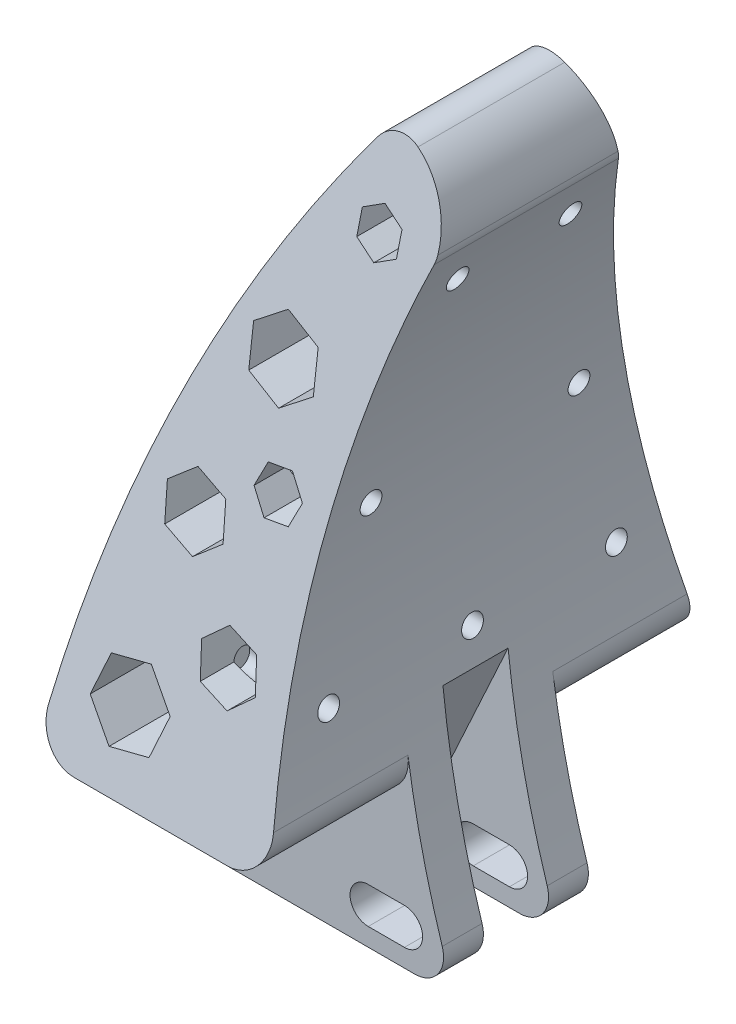
from build123d import *

# Parameters (mm, degrees)
BOSS_EXTRUDE4_DEPTH = 60
CUT_EXTRUDE2_DEPTH  = 60
SKETCH8_R           = 2.5
CUT_EXTRUDE3_DEPTH  = 60
CUT_EXTRUDE4_START  = 25.5
CUT_EXTRUDE4_DEPTH  = 9
SKETCH10_W          = 43.881633461
SKETCH10_H          = 22.720590432
CUT_EXTRUDE5_DEPTH  = 20
SKETCH11_W          = 44.457178834
SKETCH11_H          = 22.765793249
CUT_EXTRUDE6_DEPTH  = 20
FILLET1_R           = 5
FILLET2_R           = 5
FILLET3_R           = 5
FILLET4_R           = 5
CUT_EXTRUDE7_DEPTH  = 49
CUT_EXTRUDE8_DEPTH  = 15
CUT_EXTRUDE9_DEPTH  = 45
CUT_EXTRUDE10_DEPTH = 18
SKETCH14_R          = 1.5
CUT_EXTRUDE11_DEPTH = 20
SKETCH15_R          = 1.5
CUT_EXTRUDE12_DEPTH = 20
SKETCH16_R          = 1.5
CUT_EXTRUDE13_DEPTH = 20
SKETCH17_R          = 1.5
CUT_EXTRUDE14_DEPTH = 20
SKETCH18_R          = 1.5
CUT_EXTRUDE15_DEPTH = 20
SKETCH19_R          = 1.5
CUT_EXTRUDE16_DEPTH = 15
SKETCH20_R          = 1.5
CUT_EXTRUDE17_DEPTH = 15


with BuildPart() as part:
    # Sketch5 → Boss-Extrude4 (new body)
    with BuildSketch(Plane.XY):
        with BuildLine():
            Line((-5.591433469, 0), (-33.737961989, 0))
            ThreePointArc((-33.737961989, 0), (-37.261513388, 1.45252406), (-38.737847513, 4.966165783))
            ThreePointArc((-38.737847513, 4.966165783), (-31.616240623, 53.699065918), (-10.244585549, 98.070962427))
            ThreePointArc((-10.244585549, 98.070962427), (-7.858330599, 99.704279242), (-4.994698694, 99.302347885))
            ThreePointArc((-4.994698694, 99.302347885), (-1.130402236, 95.400824643), (0.061459935, 90.040401592))
            ThreePointArc((0.061459935, 90.040401592), (-0.013962808, 89.477441364), (-0.168362399, 88.93083952))
            ThreePointArc((-0.168362399, 88.93083952), (-7.882068029, 47.204430035), (-1.77951237, 5.212129342))
            ThreePointArc((-1.77951237, 5.212129342), (-2.362771411, 1.638699232), (-5.591433469, 0))
        make_face()
        Polygon((-23.793249775, 26.029552985), (-22.148877555, 31.130017156), (-25.743822989, 35.104317357), (-30.983140641, 33.978153386), (-32.627512861, 28.877689216), (-29.032567427, 24.903389015), align=None, mode=Mode.SUBTRACT)
        Polygon((-19.704548153, 50.537737556), (-20.448711238, 55.006105989), (-24.690513357, 56.595826069), (-28.18815239, 53.717177716), (-27.443989306, 49.248809284), (-23.202187187, 47.659089203), align=None, mode=Mode.SUBTRACT)
        Polygon((-12.020901099, 69.614378519), (-12.60140651, 74.617120781), (-17.224161103, 76.615759479), (-21.266410285, 73.611655915), (-20.685904874, 68.608913653), (-16.063150281, 66.610274955), align=None, mode=Mode.SUBTRACT)
        Polygon((-4.994698694, 87.366252749), (-5.009667304, 90.521352685), (-7.749548306, 92.085939457), (-10.474460698, 90.495426291), (-10.459492087, 87.340326355), (-7.719611085, 85.775739583), align=None, mode=Mode.SUBTRACT)
        Polygon((-12.020901099, 37.637700147), (-12.875266359, 41.812019441), (-16.917515541, 43.159277068), (-20.105399463, 40.332215402), (-19.251034203, 36.157896108), (-15.208785021, 34.810638481), align=None, mode=Mode.SUBTRACT)
        Polygon((-12.020901099, 55.800966029), (-10.82059125, 58.827758896), (-12.841715841, 61.380654151), (-16.063150281, 60.906756539), (-17.263460129, 57.879963671), (-15.242335538, 55.327068416), align=None, mode=Mode.SUBTRACT)
    extrude(amount=BOSS_EXTRUDE4_DEPTH)

    # Sketch7 → Cut-Extrude2 (cut)
    with BuildSketch(Plane.XY.offset(60)):
        with BuildLine():
            Line((-12, 7.5121344), (-7, 7.5121344))
            ThreePointArc((-7, 7.5121344), (-4.4878656, 5), (-7, 2.4878656))
            Line((-7, 2.4878656), (-12, 2.4878656))
            ThreePointArc((-12, 2.4878656), (-14.5121344, 5), (-12, 7.5121344))
        make_face()
    extrude(amount=-CUT_EXTRUDE2_DEPTH, mode=Mode.SUBTRACT)

    # Sketch8 → Cut-Extrude3 (cut)
    with BuildSketch(Plane.XY.offset(60)):
        with Locations((-32.283791832, 6.170765259)):
            Circle(SKETCH8_R)
    extrude(amount=-CUT_EXTRUDE3_DEPTH, mode=Mode.SUBTRACT)

    # Sketch9 → Cut-Extrude4 (cut)
    with BuildSketch(Plane.XY.offset(CUT_EXTRUDE4_START)):
        with BuildLine():
            Line((0, 0), (-18.287002555, 0))
            ThreePointArc((-18.287002555, 0), (-19.970817175, 0.920755669), (-20.104249938, 2.835231673))
            Line((-20.104249938, 2.835231673), (-7.17958851, 30.955941067))
            Line((-7.17958851, 30.955941067), (0, 0))
        make_face()
    extrude(amount=CUT_EXTRUDE4_DEPTH, mode=Mode.SUBTRACT)

    # Sketch10 → Cut-Extrude5 (cut)
    with BuildSketch(Plane(origin=(0, 0, 0), x_dir=(-1, 0, 0), z_dir=(0, 0, -1))):
        with Locations((18.890622206, 8.639704784)):
            Rectangle(SKETCH10_W, SKETCH10_H)
    extrude(amount=-CUT_EXTRUDE5_DEPTH, mode=Mode.SUBTRACT)

    # Sketch11 → Cut-Extrude6 (cut)
    with BuildSketch(Plane.XY.offset(60)):
        with Locations((-18.356989611, 8.617103375)):
            Rectangle(SKETCH11_W, SKETCH11_H)
    extrude(amount=-CUT_EXTRUDE6_DEPTH, mode=Mode.SUBTRACT)

    # Fillet1
    fillet1_edges = [part.edges().sort_by_distance(p)[0] for p in [
        (-5.544200811, 20, 50),
    ]]
    fillet(fillet1_edges, radius=FILLET1_R)

    # Fillet2
    fillet2_edges = [part.edges().sort_by_distance(p)[0] for p in [
        (-5.544200811, 20, 10),
    ]]
    fillet(fillet2_edges, radius=FILLET2_R)

    # Fillet3
    fillet3_edges = [part.edges().sort_by_distance(p)[0] for p in [
        (-38.144186452, 20, 50),
    ]]
    fillet(fillet3_edges, radius=FILLET3_R)

    # Fillet4
    fillet4_edges = [part.edges().sort_by_distance(p)[0] for p in [
        (-38.144186452, 20, 10),
    ]]
    fillet(fillet4_edges, radius=FILLET4_R)

    # Sketch12 → Cut-Extrude7 (cut)
    with BuildSketch(Plane(origin=(0, 0, 0), x_dir=(0, 0, -1), z_dir=(1, 0, 0))):
        Polygon((-60, 20), (-60, 99.809969504), (-40, 99.809969504), align=None)
    extrude(amount=-CUT_EXTRUDE7_DEPTH, mode=Mode.SUBTRACT)

    # Sketch12<2> → Cut-Extrude8 (cut)
    with BuildSketch(Plane(origin=(0, 0, 0), x_dir=(0, 0, -1), z_dir=(1, 0, 0))):
        Polygon((-60, 20), (-60, 99.809969504), (-40, 99.809969504), align=None)
    extrude(amount=CUT_EXTRUDE8_DEPTH, mode=Mode.SUBTRACT)

    # Sketch13 → Cut-Extrude9 (cut)
    with BuildSketch(Plane(origin=(0, 0, 0), x_dir=(0, 0, -1), z_dir=(1, 0, 0))):
        Polygon((0, 20), (0, 99.809969504), (-20, 99.809969504), align=None)
    extrude(amount=-CUT_EXTRUDE9_DEPTH, mode=Mode.SUBTRACT)

    # Sketch13<2> → Cut-Extrude10 (cut)
    with BuildSketch(Plane(origin=(0, 0, 0), x_dir=(0, 0, -1), z_dir=(1, 0, 0))):
        Polygon((0, 20), (0, 99.809969504), (-20, 99.809969504), align=None)
    extrude(amount=CUT_EXTRUDE10_DEPTH, mode=Mode.SUBTRACT)

    # Sketch14 → Cut-Extrude11 (cut)
    with BuildSketch(Plane(origin=(0, 0, 0), x_dir=(0, 0, -1), z_dir=(1, 0, 0))):
        with Locations((-49.873134451, 35.727910902)):
            Circle(SKETCH14_R)
    extrude(amount=-CUT_EXTRUDE11_DEPTH, mode=Mode.SUBTRACT)

    # Sketch15 → Cut-Extrude12 (cut)
    with BuildSketch(Plane(origin=(0, 0, 0), x_dir=(0, 0, -1), z_dir=(1, 0, 0))):
        with Locations((-30.002133338, 35.727910902)):
            Circle(SKETCH15_R)
    extrude(amount=-CUT_EXTRUDE12_DEPTH, mode=Mode.SUBTRACT)

    # Sketch16 → Cut-Extrude13 (cut)
    with BuildSketch(Plane(origin=(0, 0, 0), x_dir=(0, 0, -1), z_dir=(1, 0, 0))):
        with Locations((-10.126865549, 35.727910902)):
            Circle(SKETCH16_R)
    extrude(amount=-CUT_EXTRUDE13_DEPTH, mode=Mode.SUBTRACT)

    # Sketch17 → Cut-Extrude14 (cut)
    with BuildSketch(Plane(origin=(0, 0, 0), x_dir=(0, 0, -1), z_dir=(1, 0, 0))):
        with Locations((-44.360038747, 57.727910902)):
            Circle(SKETCH17_R)
    extrude(amount=-CUT_EXTRUDE14_DEPTH, mode=Mode.SUBTRACT)

    # Sketch18 → Cut-Extrude15 (cut)
    with BuildSketch(Plane(origin=(0, 0, 0), x_dir=(0, 0, -1), z_dir=(1, 0, 0))):
        with Locations((-15.639961253, 57.727910902)):
            Circle(SKETCH18_R)
    extrude(amount=-CUT_EXTRUDE15_DEPTH, mode=Mode.SUBTRACT)

    # Sketch19 → Cut-Extrude16 (cut)
    with BuildSketch(Plane(origin=(0, 0, 0), x_dir=(0, 0, -1), z_dir=(1, 0, 0))):
        with Locations((-37.793709057, 83.93083952)):
            Circle(SKETCH19_R)
    extrude(amount=-CUT_EXTRUDE16_DEPTH, mode=Mode.SUBTRACT)

    # Sketch20 → Cut-Extrude17 (cut)
    with BuildSketch(Plane(origin=(0, 0, 0), x_dir=(0, 0, -1), z_dir=(1, 0, 0))):
        with Locations((-22.206290943, 83.93083952)):
            Circle(SKETCH20_R)
    extrude(amount=-CUT_EXTRUDE17_DEPTH, mode=Mode.SUBTRACT)


solid = part.part
